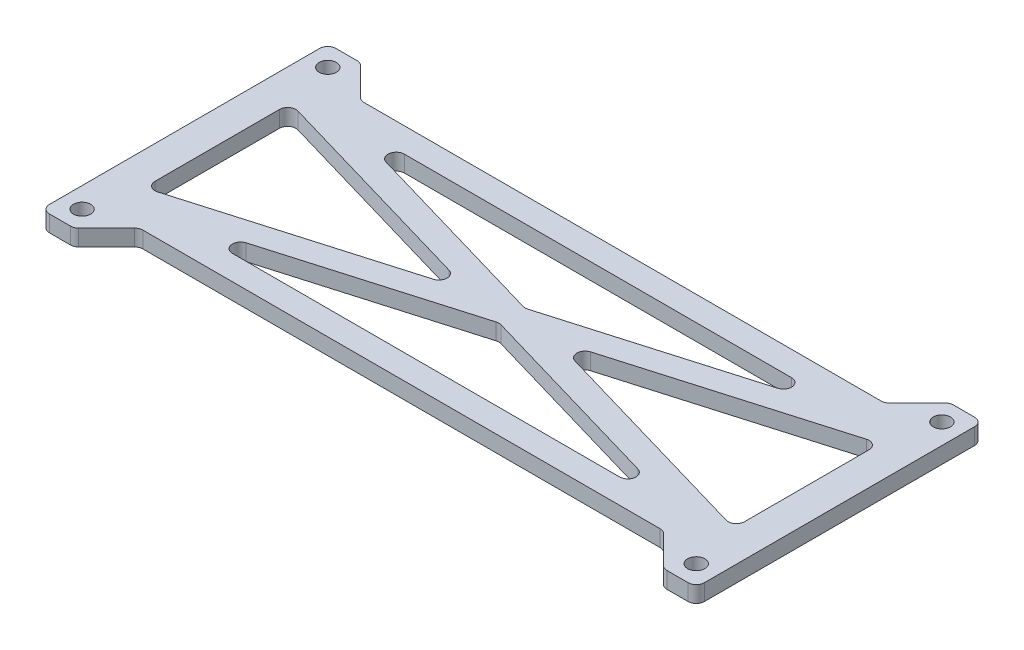
from build123d import *

# Parameters (mm, degrees)
SKETCH_2_R      = 1.05
EXTRUDE_1_DEPTH = 2
FILLET_1_R      = 1


with BuildPart() as part:
    # 草图2 → 凸台-拉伸1 (new body)
    with BuildSketch(Plane(origin=(0, 0, 0), x_dir=(1, 0, 0), z_dir=(0, 1, 0))):
        Polygon((-36, 17.5), (-32, 13.5), (32, 13.5), (36, 17.5), (40, 17.5), (40, -17.5), (36, -17.5), (32, -13.5), (-32, -13.5), (-36, -17.5), (-40, -17.5), (-40, 17.5), align=None)
        with Locations(Location((-37.5, 15, 0), (0, 0, 270))):
            Circle(SKETCH_2_R, mode=Mode.SUBTRACT)
        with Locations(Location((37.5, 15, 0), (0, 0, 270))):
            Circle(SKETCH_2_R, mode=Mode.SUBTRACT)
        with Locations(Location((37.5, -15, 0), (0, 0, 270))):
            Circle(SKETCH_2_R, mode=Mode.SUBTRACT)
        with Locations(Location((-37.5, -15, 0), (0, 0, 270))):
            Circle(SKETCH_2_R, mode=Mode.SUBTRACT)
        Polygon((30.642857143, 10.5), (0, 1.5625), (-30.642857143, 10.5), align=None, mode=Mode.SUBTRACT)
        Polygon((-30.642857143, -10.5), (0, -1.5625), (30.642857143, -10.5), align=None, mode=Mode.SUBTRACT)
        Polygon((-36, 8.9375), (-5.357142857, 0), (-36, -8.9375), align=None, mode=Mode.SUBTRACT)
        Polygon((36, -8.9375), (36, 8.9375), (5.357142857, 0), align=None, mode=Mode.SUBTRACT)
    extrude(amount=EXTRUDE_1_DEPTH)

    # 圆角1
    fillet_1_edges = [part.edges().sort_by_distance(p)[0] for p in [
        (-30.642857143, 1, 10.5),
        (30.642857143, 1, 10.5),
        (0, 1, 1.5625),
        (36, 1, 8.9375),
        (36, 1, -8.9375),
        (5.357142857, 1, 0),
        (-36, 1, -8.9375),
        (-36, 1, 8.9375),
        (-5.357142857, 1, 0),
        (-40, 1, 17.5),
        (-40, 1, -17.5),
        (-36, 1, -17.5),
        (-32, 1, -13.5),
        (32, 1, -13.5),
        (36, 1, -17.5),
        (40, 1, -17.5),
        (40, 1, 17.5),
        (36, 1, 17.5),
        (32, 1, 13.5),
        (-32, 1, 13.5),
        (-36, 1, 17.5),
        (-30.642857143, 1, -10.5),
        (0, 1, -1.5625),
        (30.642857143, 1, -10.5),
    ]]
    fillet(fillet_1_edges, radius=FILLET_1_R)


solid = part.part
